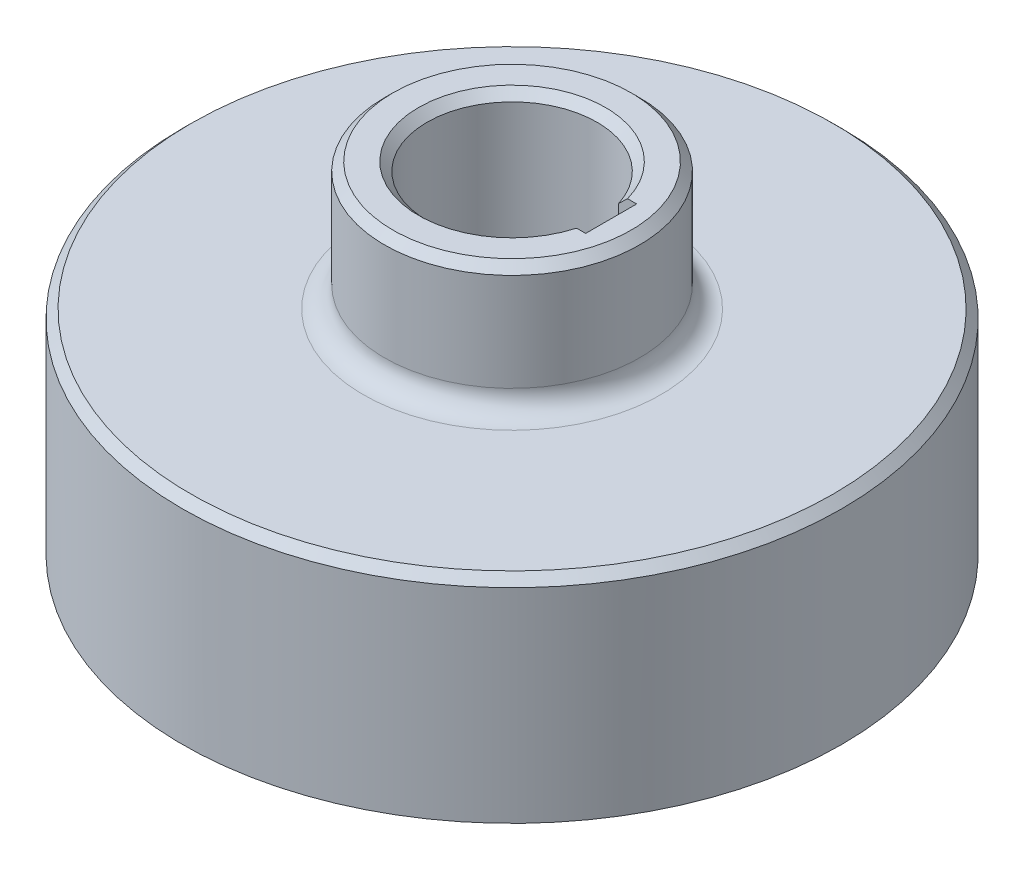
from build123d import *

# Parameters (mm, degrees)
FILLET1_R                    = 1.5
CUT_EXTRUDE1_START           = -35
CUT_EXTRUDE1_DEPTH           = 35
FILLET2_R                    = 2
CIRPATTERN1_COUNT            = 6
FILLET2_OF_CIRPATTERN1_R     = 2
FILLET3_R                    = 5
CHAMFER1_SIZE                = 2
CHAMFER3_SIZE                = 1
CUT_EXTRUDE2_REACH           = 152.223
SKETCH3_W                    = 12
SKETCH3_H                    = 35
CHAMFER4_SIZE                = 0.5
CIRPATTERN2_COUNT            = 6
CHAMFER4_OF_CIRPATTERN2_SIZE = 0.5


with BuildPart() as part:
    # Sketch1 → Revolve1 (revolve)
    with BuildSketch(Plane.XY):
        Polygon((20, 80), (30, 80), (30, 50), (77.5, 50), (77.5, 0), (63, 0), (63, 35), (70, 35), (70, 40), (25, 40), (25, 45), (20, 45), align=None)
    revolve(axis=Axis((0, -1292.390356755, 0), (0, 1, 0)))

    # Fillet1
    fillet1_edges = [part.edges().sort_by_distance(p)[0] for p in [
        (-70, 40, 0),
    ]]
    fillet(fillet1_edges, radius=FILLET1_R)

    # Sketch2 → Cut-Extrude1 (cut)
    with BuildSketch(Plane.XZ.offset(CUT_EXTRUDE1_START)):
        with BuildLine():
            Line((-6.125, 68.8), (6.125, 68.8))
            Line((6.125, 68.8), (6.125, 62.701550021))
            ThreePointArc((6.125, 62.701550021), (0, 63), (-6.125, 62.701550021))
            Line((-6.125, 62.701550021), (-6.125, 68.8))
        make_face()
    cut_extrude1 = extrude(amount=CUT_EXTRUDE1_DEPTH, mode=Mode.SUBTRACT)

    # Fillet2
    fillet2_edges = [part.edges().sort_by_distance(p)[0] for p in [
        (6.125, 17.5, 62.701550021),
        (-6.125, 17.5, 62.701550021),
    ]]
    fillet(fillet2_edges, radius=FILLET2_R)

    # CirPattern1: Cut-Extrude1 ×6 about axis
    cirpattern1_axis = Axis((0, 0, 0), (0, 1, 0))
    for i in range(1, CIRPATTERN1_COUNT):
        add(cut_extrude1.rotate(cirpattern1_axis, i * 360 / CIRPATTERN1_COUNT), mode=Mode.SUBTRACT)

    # Fillet2 of CirPattern1
    fillet2_of_cirpattern1_edges = [part.edges().sort_by_distance(p)[0] for p in [
        (57.363635175, 17.5, 26.046369412),
        (51.238635175, 17.5, 36.655180609),
        (51.238635175, 17.5, -36.655180609),
        (57.363635175, 17.5, -26.046369412),
        (-6.125, 17.5, -62.701550021),
        (6.125, 17.5, -62.701550021),
        (-57.363635175, 17.5, -26.046369412),
        (-51.238635175, 17.5, -36.655180609),
        (-51.238635175, 17.5, 36.655180609),
        (-57.363635175, 17.5, 26.046369412),
    ]]
    fillet(fillet2_of_cirpattern1_edges, radius=FILLET2_OF_CIRPATTERN1_R)

    # Fillet3
    fillet3_edges = [part.edges().sort_by_distance(p)[0] for p in [
        (-30, 50, 0),
    ]]
    fillet(fillet3_edges, radius=FILLET3_R)

    # Chamfer1
    chamfer1_edges = [part.edges().sort_by_distance(p)[0] for p in [
        (-77.5, 50, 0),
        (-30, 80, 0),
        (-20, 80, 0),
    ]]
    chamfer(chamfer1_edges, length=CHAMFER1_SIZE)

    # Chamfer3
    chamfer3_edges = [part.edges().sort_by_distance(p)[0] for p in [
        (-25, 40, 0),
        (-20, 45, 0),
    ]]
    chamfer(chamfer3_edges, length=CHAMFER3_SIZE)

    # Sketch3 → Cut-Extrude2 (cut, up to next)
    with BuildSketch(Plane(origin=(23.3, 0, 0), x_dir=(0, 0, -1), z_dir=(1, 0, 0)), mode=Mode.PRIVATE) as cut_extrude2_sk1:
        with Locations((0, 62.5)):
            Rectangle(SKETCH3_W, SKETCH3_H)
    cut_extrude2_tool1 = extrude(cut_extrude2_sk1.sketch, amount=-CUT_EXTRUDE2_REACH, mode=Mode.PRIVATE) & part.part
    add(cut_extrude2_tool1.solids().sort_by_distance((23.3, 62.5, 0))[0], mode=Mode.SUBTRACT)

    # Sketch6 → Cut-Revolve1 (revolve, cut)
    with BuildSketch(Plane.XY, mode=Mode.PRIVATE) as cut_revolve1_sk:
        Polygon((-67.75, 0), (-67.75, 10), (-70.25, 11.443375673), (-70.25, 0), align=None)
    cut_revolve1 = revolve(cut_revolve1_sk.sketch.rotate(Axis((-70.25, -967.908056453, 0), (0, 1, 0)), 90), axis=Axis((-70.25, -967.908056453, 0), (0, 1, 0)), mode=Mode.SUBTRACT)

    # Chamfer4
    chamfer4_edges = [part.edges().sort_by_distance(p)[0] for p in [
        (-70.25, 0, 2.5),
    ]]
    chamfer(chamfer4_edges, length=CHAMFER4_SIZE)

    # CirPattern2: Cut-Revolve1 ×6 about axis
    cirpattern2_axis = Axis((0, 0, 0), (0, 1, 0))
    for i in range(1, CIRPATTERN2_COUNT):
        add(cut_revolve1.rotate(cirpattern2_axis, i * 360 / CIRPATTERN2_COUNT), mode=Mode.SUBTRACT)

    # Chamfer4 of CirPattern2
    chamfer4_of_cirpattern2_edges = [part.edges().sort_by_distance(p)[0] for p in [
        (-32.959936491, 0, 62.088284616),
        (37.290063509, 0, 59.588284616),
        (70.25, 0, -2.5),
        (32.959936491, 0, -62.088284616),
        (-37.290063509, 0, -59.588284616),
    ]]
    chamfer(chamfer4_of_cirpattern2_edges, length=CHAMFER4_OF_CIRPATTERN2_SIZE)


solid = part.part
